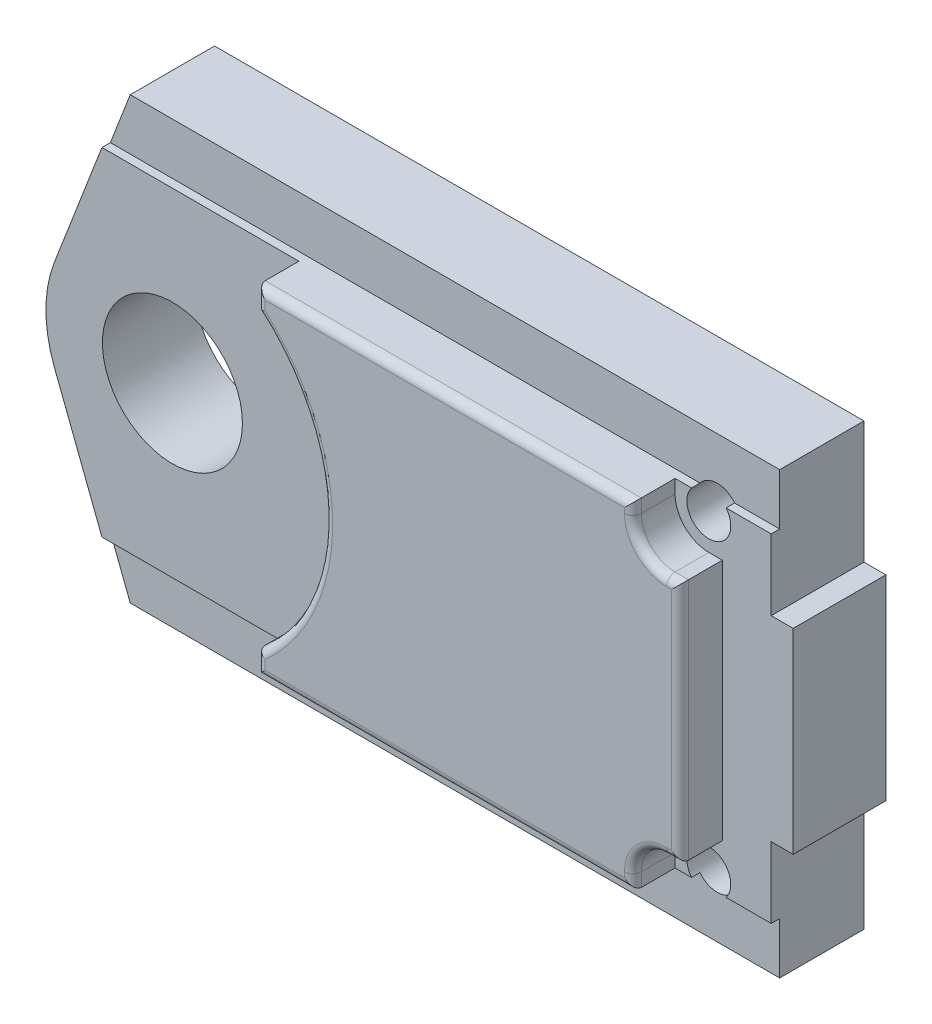
from build123d import *

# Parameters (mm, degrees)
SKETCH1_R          = 1.3
SKETCH1_R_2        = 4.15
EXTRUDE1_DEPTH     = 5.5
EXTRUDE2_DEPTH     = 2.5
FILLET1_R          = 0.5
CUT_EXTRUDE1_DEPTH = 0.5


with BuildPart() as part:
    # Sketch1 → Extrude1 (new body)
    with BuildSketch(Plane.XY):
        with BuildLine():
            Line((35.5, 5.8), (36.8, 5.8))
            Line((36.8, 5.8), (36.8, -5.8))
            Line((36.8, -5.8), (35.5, -5.8))
            Line((35.5, -5.8), (35.5, -13.05))
            Line((35.5, -13.05), (-3.00020865, -13.05))
            Line((-3.00020865, -13.05), (-6.99642445, -2.701859528))
            ThreePointArc((-6.99642445, -2.701859528), (-7.5, 0), (-6.99642445, 2.701859528))
            Line((-6.99642445, 2.701859528), (-3.00020865, 13.05))
            Line((-3.00020865, 13.05), (35.5, 13.05))
            Line((35.5, 13.05), (35.5, 5.8))
        make_face()
        with Locations((31.8, 9.2)):
            Circle(SKETCH1_R, mode=Mode.SUBTRACT)
        with Locations(Location((31.8, -9.2, 0), (0, 0, 180))):
            Circle(SKETCH1_R, mode=Mode.SUBTRACT)
        Circle(SKETCH1_R_2, mode=Mode.SUBTRACT)
    extrude(amount=EXTRUDE1_DEPTH)

    # Sketch2 → Extrude2 (add)
    with BuildSketch(Plane.XY.offset(5.5)):
        with BuildLine():
            Line((7.5, 10), (29.8, 10))
            Line((29.8, 10), (29.8, 9.2))
            ThreePointArc((29.8, 9.2), (30.385786438, 7.785786438), (31.8, 7.2))
            Line((31.8, 7.2), (32.6, 7.2))
            Line((32.6, 7.2), (32.6, -7.2))
            Line((32.6, -7.2), (31.8, -7.2))
            ThreePointArc((31.8, -7.2), (30.385786438, -7.785786438), (29.8, -9.2))
            Line((29.8, -9.2), (29.8, -10))
            Line((29.8, -10), (7.5, -10))
            Line((7.5, -10), (7.5, -8.717797887))
            ThreePointArc((7.5, -8.717797887), (11.5, 0), (7.5, 8.717797887))
            Line((7.5, 8.717797887), (7.5, 10))
        make_face()
    extrude(amount=EXTRUDE2_DEPTH)

    # Fillet1
    fillet1_edges = [part.edges().sort_by_distance(p)[0] for p in [
        (30.385786438, -7.785786438, 8),
        (32.2, -7.2, 8),
        (32.6, 0, 8),
        (32.2, 7.2, 8),
        (30.385786438, 7.785786438, 8),
        (29.8, 9.6, 8),
        (18.65, 10, 8),
        (7.5, 9.358898944, 8),
        (11.5, 0, 8),
        (7.5, -9.358898944, 8),
        (18.65, -10, 8),
        (29.8, -9.6, 8),
    ]]
    fillet(fillet1_edges, radius=FILLET1_R)

    # Sketch3 → Cut-Extrude1 (cut)
    with BuildSketch(Plane.XY.offset(5.5)):
        Polygon((-4.178049077, -10), (35.5, -10), (35.5, -13.05), (-3.00020865, -13.05), align=None)
        Polygon((-4.178049077, 10), (35.5, 10), (35.5, 13.05), (-3.00020865, 13.05), align=None)
    extrude(amount=-CUT_EXTRUDE1_DEPTH, mode=Mode.SUBTRACT)


solid = part.part
